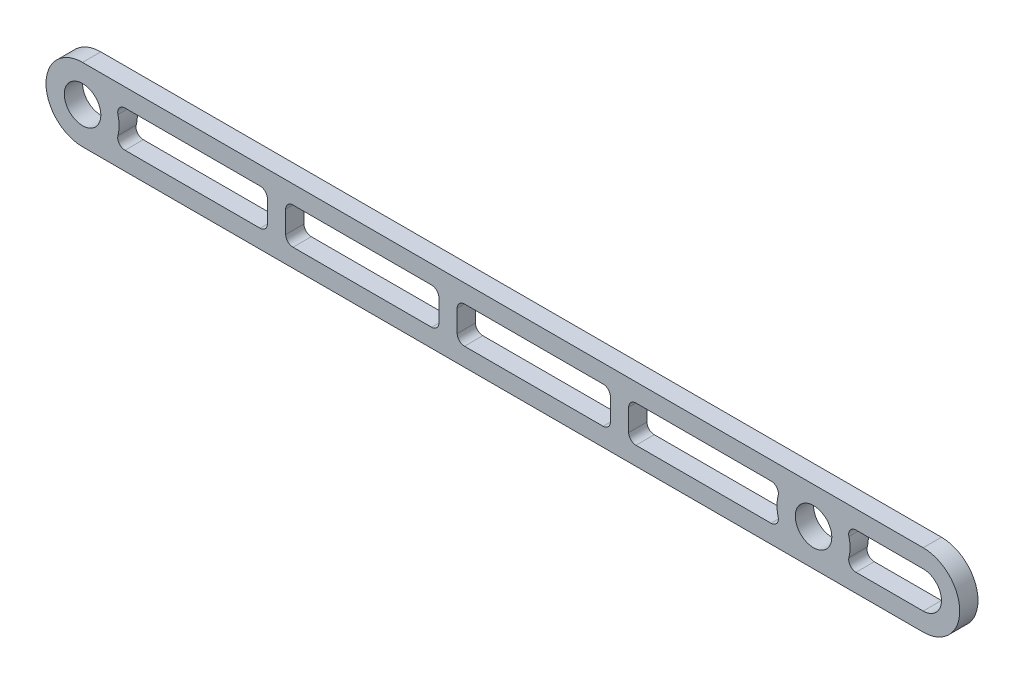
from build123d import *

# Parameters (mm, degrees)
SKETCH_1_R      = 5
SKETCH_1_W      = 41.919872981
SKETCH_1_H      = 10
EXTRUDE_1_DEPTH = 5
FILLET_1_R      = 2
FILLET_2_R      = 2


with BuildPart() as part:
    # 草图1 → 凸台-拉伸1 (new body)
    with BuildSketch(Plane.XY):
        with BuildLine():
            Line((0, 10), (230, 10))
            ThreePointArc((230, 10), (240, 0), (230, -10))
            Line((230, -10), (0, -10))
            ThreePointArc((0, -10), (-10, 0), (0, 10))
        make_face()
        Circle(SKETCH_1_R, mode=Mode.SUBTRACT)
        with Locations((200, 0)):
            Circle(SKETCH_1_R, mode=Mode.SUBTRACT)
        with BuildLine():
            Line((8.660254038, 5), (50.580127019, 5))
            Line((50.580127019, 5), (50.580127019, -5))
            Line((50.580127019, -5), (8.660254038, -5))
            ThreePointArc((8.660254038, -5), (10, 0), (8.660254038, 5))
        make_face(mode=Mode.SUBTRACT)
        with BuildLine():
            Line((208.660254038, 5), (230, 5))
            ThreePointArc((230, 5), (235, 0), (230, -5))
            Line((230, -5), (208.660254038, -5))
            ThreePointArc((208.660254038, -5), (210, 0), (208.660254038, 5))
        make_face(mode=Mode.SUBTRACT)
        with Locations((123.45993649, 0)):
            Rectangle(SKETCH_1_W, SKETCH_1_H, mode=Mode.SUBTRACT)
        with Locations((76.54006351, 0)):
            Rectangle(SKETCH_1_W, SKETCH_1_H, mode=Mode.SUBTRACT)
        with BuildLine():
            Line((149.419872981, -5), (191.339745962, -5))
            ThreePointArc((191.339745962, -5), (190, 0), (191.339745962, 5))
            Line((191.339745962, 5), (149.419872981, 5))
            Line((149.419872981, 5), (149.419872981, -5))
        make_face(mode=Mode.SUBTRACT)
    extrude(amount=EXTRUDE_1_DEPTH)

    # 圆角1
    fillet_1_edges = [part.edges().sort_by_distance(p)[0] for p in [
        (50.580127019, 5, 2.5),
    ]]
    fillet(fillet_1_edges, radius=FILLET_1_R)

    # 圆角2
    fillet_2_edges = [part.edges().sort_by_distance(p)[0] for p in [
        (208.660254038, 5, 2.5),
        (208.660254038, -5, 2.5),
        (144.419872981, 5, 2.5),
        (102.5, 5, 2.5),
        (102.5, -5, 2.5),
        (144.419872981, -5, 2.5),
        (191.339745962, -5, 2.5),
        (191.339745962, 5, 2.5),
        (149.419872981, 5, 2.5),
        (149.419872981, -5, 2.5),
        (8.660254038, 5, 2.5),
        (8.660254038, -5, 2.5),
        (50.580127019, -5, 2.5),
        (97.5, 5, 2.5),
        (55.580127019, 5, 2.5),
        (55.580127019, -5, 2.5),
        (97.5, -5, 2.5),
    ]]
    fillet(fillet_2_edges, radius=FILLET_2_R)


solid = part.part
